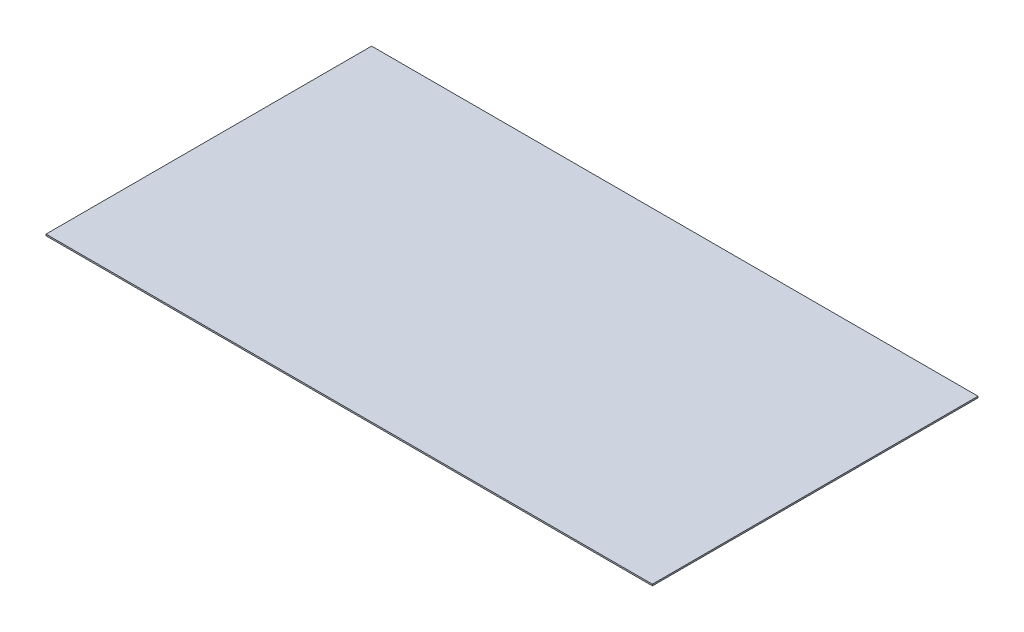
from build123d import *

# Parameters (mm, degrees)
CROQUIS1_W              = 812
CROQUIS1_H              = 436
SALIENTE_EXTRUIR1_DEPTH = 2


with BuildPart() as part:
    # Croquis1 → Saliente-Extruir1 (new body)
    with BuildSketch(Plane(origin=(0, 0, 0), x_dir=(1, 0, 0), z_dir=(0, 1, 0))):
        Rectangle(CROQUIS1_W, CROQUIS1_H)
    extrude(amount=SALIENTE_EXTRUIR1_DEPTH)


solid = part.part
